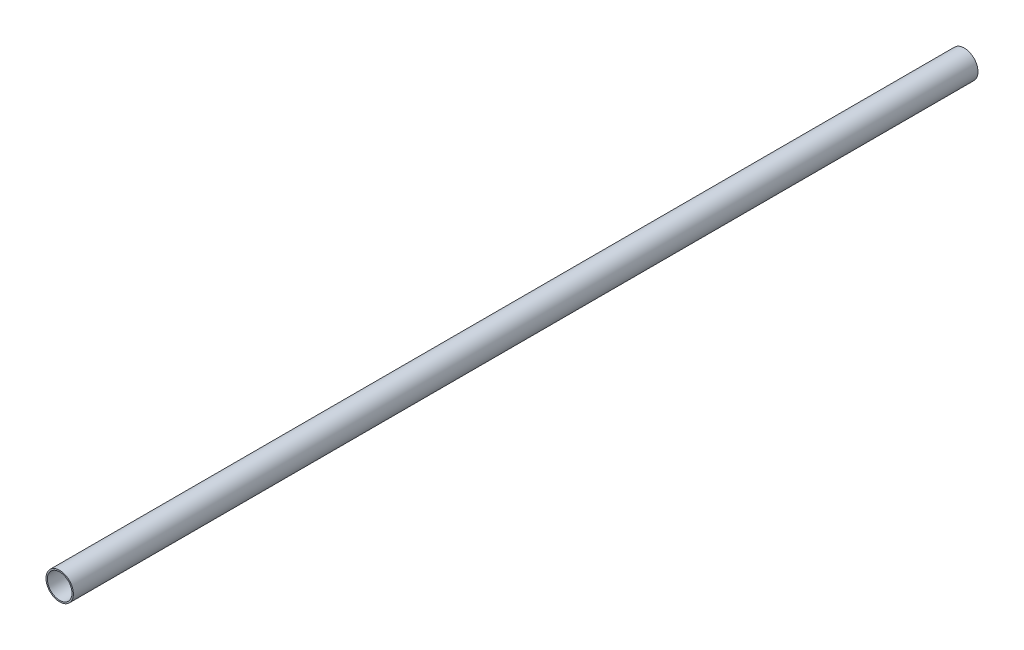
from build123d import *

# Parameters (mm, degrees)
SKIZZE1_R                       = 5
SKIZZE1_R_2                     = 4.5
AUFSATZ_LINEAR_AUSTRAGEN1_DEPTH = 330


with BuildPart() as part:
    # Skizze1 → Aufsatz-Linear austragen1 (new body)
    with BuildSketch(Plane.XY):
        Circle(SKIZZE1_R)
        Circle(SKIZZE1_R_2, mode=Mode.SUBTRACT)
    extrude(amount=AUFSATZ_LINEAR_AUSTRAGEN1_DEPTH)


solid = part.part
